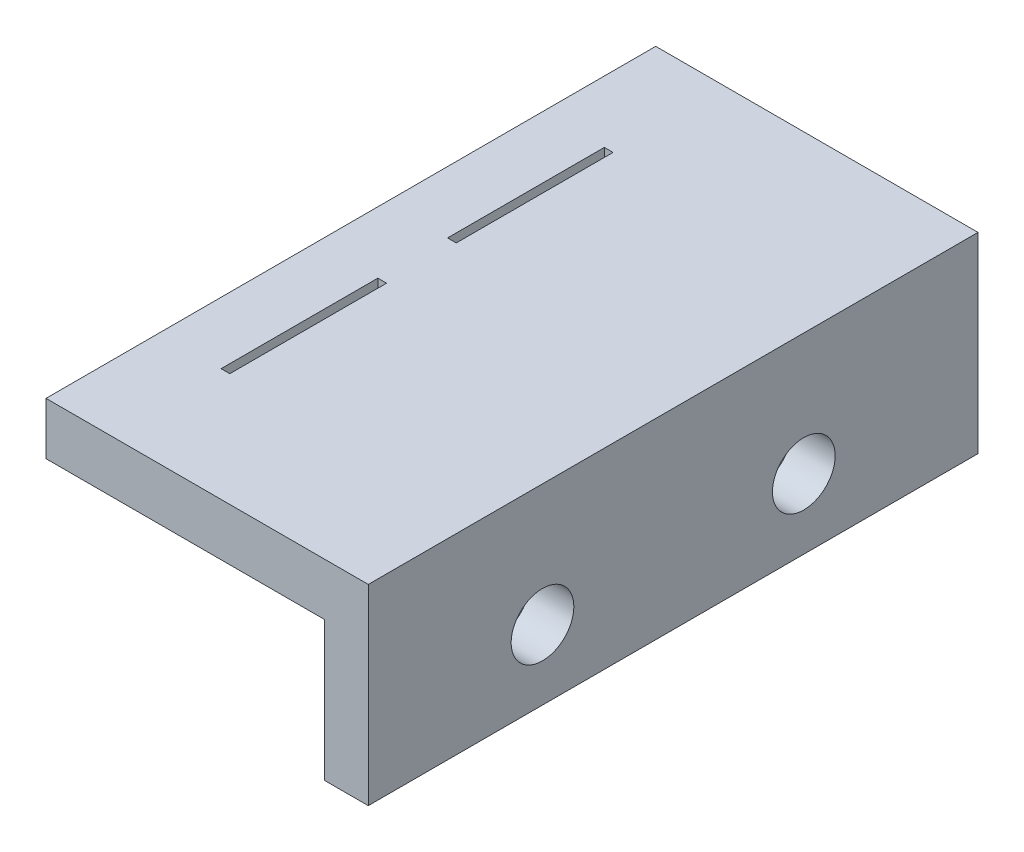
from build123d import *

# Parameters (mm, degrees)
SKETCH1_W               = 70.4
SKETCH1_H               = 2
BOSS_EXTRUDE2_DEPTH     = 10
SKETCH2_W               = 2
SKETCH2_H               = 55
BOSS_EXTRUDE3_DEPTH     = 10
SKETCH3_W               = 19
SKETCH3_H               = 3
BOSS_EXTRUDE4_DEPTH     = 2
SKETCH4_W               = 15
SKETCH4_H               = 10
CUT_EXTRUDE2_DEPTH      = 2
SKETCH5_W               = 2
SKETCH5_H               = 3
BOSS_EXTRUDE5_DEPTH     = 1
SKETCH6_W               = 2
SKETCH6_H               = 3
BOSS_EXTRUDE6_DEPTH     = 1
SKETCH7_W               = 57
SKETCH7_H               = 2
BOSS_EXTRUDE7_DEPTH     = 6.6
SKETCH8_W               = 57
SKETCH8_H               = 2
BOSS_EXTRUDE8_DEPTH     = 6.6
BOSS_EXTRUDE9_DEPTH     = 5
SKETCH12_W              = 2
SKETCH12_H              = 5
SKETCH12_H_2            = 40
SKETCH12_H_3            = 30
BOSS_EXTRUDE10_DEPTH    = 20
BOSS_EXTRUDE11_DEPTH    = 3
SKETCH14_W              = 0.5
SKETCH14_H              = 9
CUT_EXTRUDE3_DEPTH      = 3
SKETCH15_W              = 38.4
SKETCH15_H              = 45
CUT_EXTRUDE4_DEPTH      = 3
BOSS_EXTRUDE12_DEPTH    = 0.5
SKETCH17_R              = 1.8
SKETCH17_W              = 3
SKETCH17_H              = 5
CUT_EXTRUDE6_DEPTH      = 3
CUT_EXTRUDE7_DEPTH      = 71
CUT_EXTRUDE7_DEPTH_BACK = 51
SKETCH18_W              = 76.208755975
SKETCH18_H              = 59.797515132
CUT_EXTRUDE8_DEPTH      = 87
CUT_EXTRUDE8_DEPTH_BACK = 25
SKETCH19_W              = 80.230135701
SKETCH19_H              = 33.851054281
SKETCH20_W              = 35
SKETCH20_H              = 3
BOSS_EXTRUDE13_DEPTH    = 2.5
SKETCH21_W              = 2.5
SKETCH21_H              = 35
BOSS_EXTRUDE14_DEPTH    = 8
SKETCH22_R              = 1.8
CUT_EXTRUDE10_DEPTH     = 10


with BuildPart() as part:
    # Sketch1 → Boss-Extrude2 (new body)
    with BuildSketch(Plane(origin=(0, 0, 0), x_dir=(1, 0, 0), z_dir=(0, 1, 0))):
        with Locations((35.2, 1)):
            Rectangle(SKETCH1_W, SKETCH1_H)
    extrude(amount=BOSS_EXTRUDE2_DEPTH)

    # Sketch2 → Boss-Extrude3 (add)
    with BuildSketch(Plane(origin=(0, 10, 0), x_dir=(1, 0, 0), z_dir=(0, 1, 0))):
        with Locations((1, 29.5)):
            Rectangle(SKETCH2_W, SKETCH2_H)
        with Locations((69.4, 29.5)):
            Rectangle(SKETCH2_W, SKETCH2_H)
    extrude(amount=-BOSS_EXTRUDE3_DEPTH)

    # Sketch3 → Boss-Extrude4 (add)
    with BuildSketch(Plane.XY):
        with Locations((35.2, 11.5)):
            Rectangle(SKETCH3_W, SKETCH3_H)
    extrude(amount=-BOSS_EXTRUDE4_DEPTH)

    # Sketch4 → Cut-Extrude2 (cut)
    with BuildSketch(Plane.XY):
        with Locations((35.2, 5)):
            Rectangle(SKETCH4_W, SKETCH4_H)
    extrude(amount=-CUT_EXTRUDE2_DEPTH, mode=Mode.SUBTRACT)

    # Sketch5 → Boss-Extrude5 (add)
    with BuildSketch(Plane.ZY.offset(-25.7)):
        with Locations((-1, 11.5)):
            Rectangle(SKETCH5_W, SKETCH5_H)
    extrude(amount=BOSS_EXTRUDE5_DEPTH)

    # Sketch6 → Boss-Extrude6 (add)
    with BuildSketch(Plane(origin=(44.7, 0, 0), x_dir=(0, 0, -1), z_dir=(1, 0, 0))):
        with Locations((1, 11.5)):
            Rectangle(SKETCH6_W, SKETCH6_H)
    extrude(amount=BOSS_EXTRUDE6_DEPTH)

    # Sketch7 → Boss-Extrude7 (add)
    with BuildSketch(Plane.ZY):
        with Locations((-28.5, 1)):
            Rectangle(SKETCH7_W, SKETCH7_H)
    extrude(amount=BOSS_EXTRUDE7_DEPTH)

    # Sketch8 → Boss-Extrude8 (add)
    with BuildSketch(Plane(origin=(70.4, 0, 0), x_dir=(0, 0, -1), z_dir=(1, 0, 0))):
        with Locations((28.5, 1)):
            Rectangle(SKETCH8_W, SKETCH8_H)
    extrude(amount=BOSS_EXTRUDE8_DEPTH)

    # Sketch10 → Boss-Extrude9 (add)
    with BuildSketch(Plane(origin=(0, 0, -57), x_dir=(-1, 0, 0), z_dir=(0, 0, -1))):
        Polygon((-2, 10), (-2, 0), (6.6, 0), (6.6, 2), (0, 2), (0, 10), align=None)
        Polygon((-77, 0), (-68.4, 0), (-68.4, 10), (-70.4, 10), (-70.4, 2), (-77, 2), align=None)
    extrude(amount=BOSS_EXTRUDE9_DEPTH)

    # Sketch12 → Boss-Extrude10 (add)
    with BuildSketch(Plane(origin=(0, 10, 0), x_dir=(1, 0, 0), z_dir=(0, 1, 0))):
        with Locations((1, 59.5)):
            Rectangle(SKETCH12_W, SKETCH12_H)
        with Locations((1, 37)):
            Rectangle(SKETCH12_W, SKETCH12_H_2)
        with Locations((69.4, 42)):
            Rectangle(SKETCH12_W, SKETCH12_H_3)
        with Locations((69.4, 59.5)):
            Rectangle(SKETCH12_W, SKETCH12_H)
    extrude(amount=BOSS_EXTRUDE10_DEPTH)

    # Sketch13 → Boss-Extrude11 (add)
    with BuildSketch(Plane(origin=(0, 30, 0), x_dir=(1, 0, 0), z_dir=(0, 1, 0))):
        Polygon((0, 17), (35.2, 17), (35.2, 27), (70.4, 27), (70.4, 62), (0, 62), align=None)
    extrude(amount=BOSS_EXTRUDE11_DEPTH)

    # Sketch14 → Cut-Extrude3 (cut)
    with BuildSketch(Plane(origin=(0, 33, 0), x_dir=(1, 0, 0), z_dir=(0, 1, 0))):
        with Locations((11.7, 51)):
            Rectangle(SKETCH14_W, SKETCH14_H)
        with Locations((11.7, 38)):
            Rectangle(SKETCH14_W, SKETCH14_H)
        with Locations((11.7, 25.5)):
            Rectangle(SKETCH14_W, SKETCH14_H)
        with Locations((58.2, 51)):
            Rectangle(SKETCH14_W, SKETCH14_H)
        with Locations((58.2, 38)):
            Rectangle(SKETCH14_W, SKETCH14_H)
    extrude(amount=-CUT_EXTRUDE3_DEPTH, mode=Mode.SUBTRACT)

    # Sketch15 → Cut-Extrude4 (cut)
    with BuildSketch(Plane(origin=(0, 33, 0), x_dir=(1, 0, 0), z_dir=(0, 1, 0))):
        with Locations((35.2, 39.5)):
            Rectangle(SKETCH15_W, SKETCH15_H)
    extrude(amount=-CUT_EXTRUDE4_DEPTH, mode=Mode.SUBTRACT)

    # Sketch16 → Boss-Extrude12 (add)
    with BuildSketch(Plane.XY):
        Polygon((-6.6, 0), (27.7, 0), (27.7, 10), (42.7, 10), (42.7, 0), (77, 0), (77, 2), (70.4, 2), (70.4, 10), (45.7, 10), (45.7, 13), (24.7, 13), (24.7, 10), (0, 10), (0, 2), (-6.6, 2), align=None)
    extrude(amount=BOSS_EXTRUDE12_DEPTH)

    # Sketch17 → Cut-Extrude6 (cut)
    with BuildSketch(Plane(origin=(0, 2, 0), x_dir=(1, 0, 0), z_dir=(0, 1, 0))):
        with Locations(Location((-3.3, 55, 0), (0, 0, 270))):
            Circle(SKETCH17_R)
        with Locations(Location((73.7, 55, 0), (0, 0, 270))):
            Circle(SKETCH17_R)
        with Locations(Location((-3.3, 6.5, 0), (0, 0, 270))):
            Circle(SKETCH17_R)
        with Locations(Location((73.7, 6.5, 0), (0, 0, 270))):
            Circle(SKETCH17_R)
        with Locations(Location((-3.3, 30.75, 0), (0, 0, 270))):
            Circle(SKETCH17_R)
        with Locations(Location((73.7, 30.75, 0), (0, 0, 270))):
            Circle(SKETCH17_R)
        with Locations((-3.3, 14.5)):
            Rectangle(SKETCH17_W, SKETCH17_H)
        with Locations((73.7, 14.5)):
            Rectangle(SKETCH17_W, SKETCH17_H)
    extrude(amount=-CUT_EXTRUDE6_DEPTH, mode=Mode.SUBTRACT)

    # Sketch18 → Cut-Extrude7 (cut, two sides: drawn at the far end of the back side and taken through both)
    with BuildSketch(Plane.ZY.offset(-CUT_EXTRUDE7_DEPTH_BACK)):
        with Locations((-23.895622013, 3.101242434)):
            Rectangle(SKETCH18_W, SKETCH18_H)
    extrude(amount=CUT_EXTRUDE7_DEPTH + CUT_EXTRUDE7_DEPTH_BACK, mode=Mode.SUBTRACT)

    # Sketch19 → Cut-Extrude8 (cut, two sides: drawn at the far end of the back side and taken through both)
    with BuildSketch(Plane.ZY.offset(-68.4).offset(-CUT_EXTRUDE8_DEPTH_BACK)):
        with Locations((-21.88493215, 13.07447286)):
            Rectangle(SKETCH19_W, SKETCH19_H)
    extrude(amount=CUT_EXTRUDE8_DEPTH + CUT_EXTRUDE8_DEPTH_BACK, mode=Mode.SUBTRACT)

    # Sketch20 → Boss-Extrude13 (add)
    with BuildSketch(Plane(origin=(70.4, 0, 0), x_dir=(0, 0, -1), z_dir=(1, 0, 0))):
        with Locations((44.5, 31.5)):
            Rectangle(SKETCH20_W, SKETCH20_H)
    extrude(amount=BOSS_EXTRUDE13_DEPTH)

    # Sketch21 → Boss-Extrude14 (add)
    with BuildSketch(Plane.XZ.offset(-30)):
        with Locations((71.65, -44.5)):
            Rectangle(SKETCH21_W, SKETCH21_H)
    extrude(amount=BOSS_EXTRUDE14_DEPTH)

    # Sketch22 → Cut-Extrude10 (cut)
    with BuildSketch(Plane.ZY.offset(-70.4)):
        with Locations((-52, 26)):
            Circle(SKETCH22_R)
        with Locations((-37, 26)):
            Circle(SKETCH22_R)
    extrude(amount=-CUT_EXTRUDE10_DEPTH, mode=Mode.SUBTRACT)


solid = part.part
